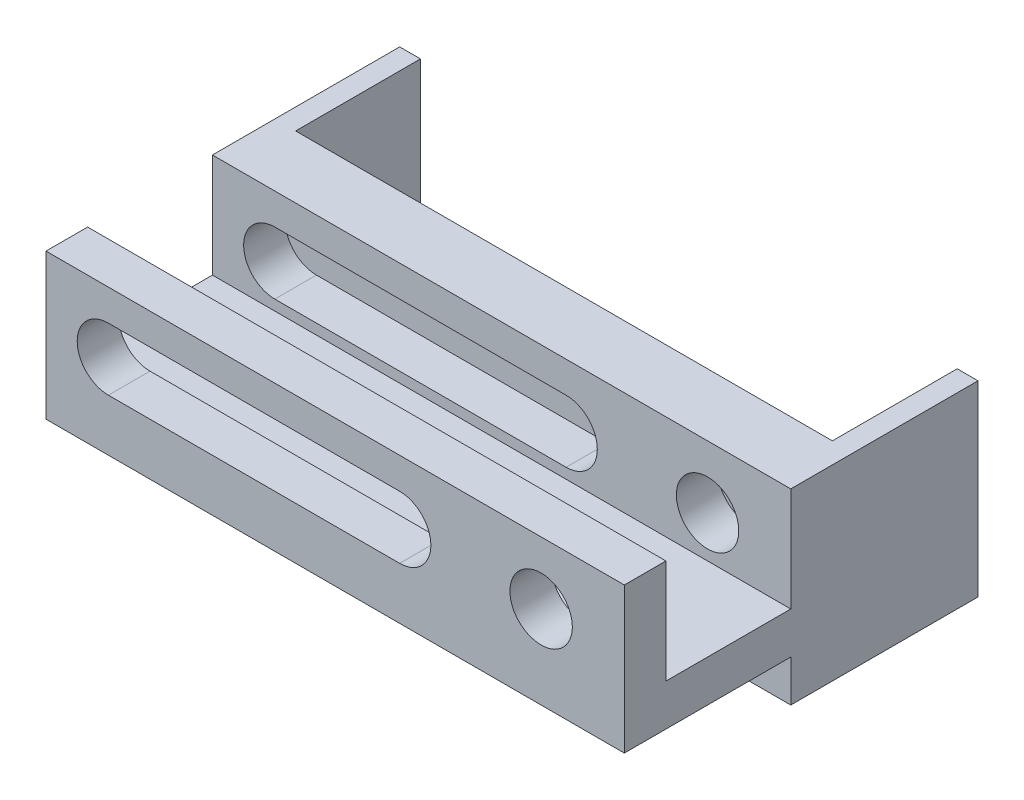
from build123d import *

# Parameters (mm, degrees)
BOSS_EXTRUDE1_DEPTH = 139
SKETCH5_R           = 7.5
CUT_EXTRUDE1_DEPTH  = 152.809090637
SKETCH6_W           = 5
SKETCH6_H           = 35
BOSS_EXTRUDE2_DEPTH = 35
SKETCH7_W           = 129
SKETCH7_H           = 35
BOSS_EXTRUDE3_DEPTH = 5


with BuildPart() as part:
    # Sketch3 → Boss-Extrude1 (new body)
    with BuildSketch(Plane(origin=(0, 0, 0), x_dir=(0, 0, -1), z_dir=(1, 0, 0))):
        Polygon((-27.8080918, 35), (-27.8080918, 10), (2.1919082, 10), (2.1919082, 35), (12.1919082, 35), (12.1919082, 0), (47.1919082, 0), (47.1919082, -10), (2.1919082, -10), (2.1919082, 0), (-37.8080918, 0), (-37.8080918, 35), align=None)
    extrude(amount=BOSS_EXTRUDE1_DEPTH)

    # Sketch5 → Cut-Extrude1 (cut, through all)
    with BuildSketch(Plane(origin=(0, 0, -12.1919082), x_dir=(-1, 0, 0), z_dir=(0, 0, -1))):
        with Locations(Location((-119, 20, 0), (0, 0, 90))):
            Circle(SKETCH5_R)
        with BuildLine():
            Line((-85, 27.5), (-15, 27.5))
            ThreePointArc((-15, 27.5), (-7.5, 20), (-15, 12.5))
            Line((-15, 12.5), (-85, 12.5))
            ThreePointArc((-85, 12.5), (-92.5, 20), (-85, 27.5))
        make_face()
    extrude(amount=-CUT_EXTRUDE1_DEPTH, mode=Mode.SUBTRACT)

    # Sketch6 → Boss-Extrude2 (add)
    with BuildSketch(Plane(origin=(0, 0, 0), x_dir=(1, 0, 0), z_dir=(0, 1, 0))):
        with Locations((2.5, 29.6919082)):
            Rectangle(SKETCH6_W, SKETCH6_H)
        with Locations((136.5, 29.6919082)):
            Rectangle(SKETCH6_W, SKETCH6_H)
    extrude(amount=BOSS_EXTRUDE2_DEPTH)

    # Sketch7 → Boss-Extrude3 (add)
    with BuildSketch(Plane(origin=(0, 0, -12.1919082), x_dir=(-1, 0, 0), z_dir=(0, 0, -1))):
        with Locations((-69.5, 17.5)):
            Rectangle(SKETCH7_W, SKETCH7_H)
    extrude(amount=BOSS_EXTRUDE3_DEPTH)


solid = part.part
